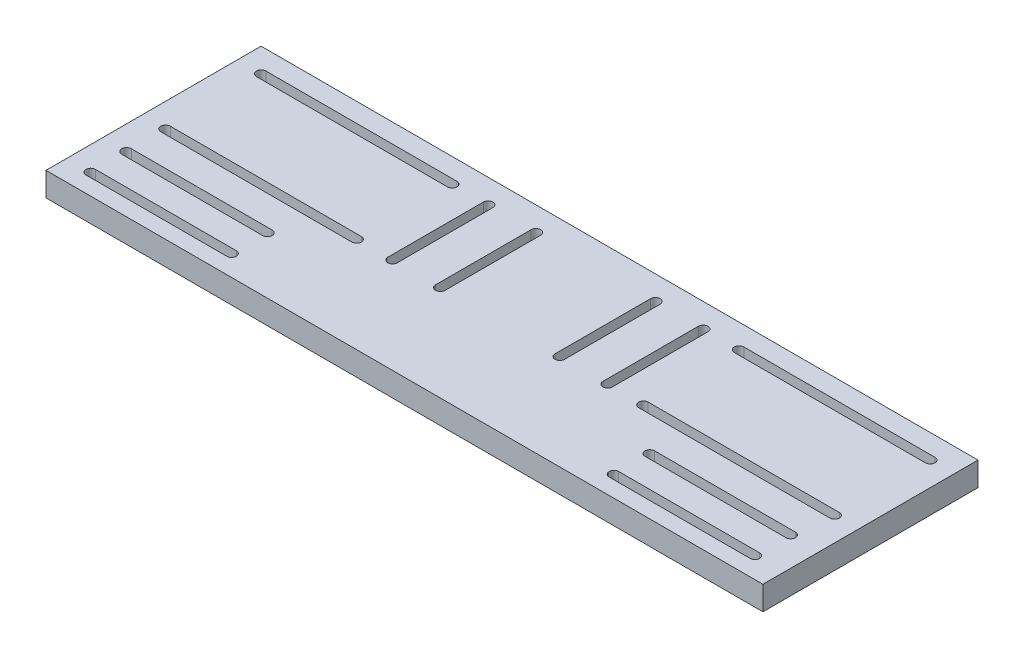
from build123d import *

# Parameters (mm, degrees)
SKETCH1_W           = 300
SKETCH1_H           = 30
BOSS_EXTRUDE1_DEPTH = 10
SKETCH2_W           = 300
SKETCH2_H           = 10
BOSS_EXTRUDE2_DEPTH = 60
CUT_EXTRUDE1_DEPTH  = 307.1045573


with BuildPart() as part:
    # Sketch1 → Boss-Extrude1 (new body)
    with BuildSketch(Plane(origin=(0, 0, 0), x_dir=(1, 0, 0), z_dir=(0, 1, 0))):
        with Locations((150, -15)):
            Rectangle(SKETCH1_W, SKETCH1_H)
        with BuildLine():
            Line((68.977444605, -8.309450677), (10, -8.309450677))
            ThreePointArc((10, -8.309450677), (8, -6.309450677), (10, -4.309450677))
            Line((10, -4.309450677), (68.977444605, -4.309450677))
            ThreePointArc((68.977444605, -4.309450677), (70.977444605, -6.309450677), (68.977444605, -8.309450677))
        make_face(mode=Mode.SUBTRACT)
        with BuildLine():
            Line((68.977444605, -23.309450677), (10, -23.309450677))
            ThreePointArc((10, -23.309450677), (8, -21.309450677), (10, -19.309450677))
            Line((10, -19.309450677), (68.977444605, -19.309450677))
            ThreePointArc((68.977444605, -19.309450677), (70.977444605, -21.309450677), (68.977444605, -23.309450677))
        make_face(mode=Mode.SUBTRACT)
        with BuildLine():
            Line((228.977444605, -23.309450677), (287.95488921, -23.309450677))
            ThreePointArc((287.95488921, -23.309450677), (289.95488921, -21.309450677), (287.95488921, -19.309450677))
            Line((287.95488921, -19.309450677), (228.977444605, -19.309450677))
            ThreePointArc((228.977444605, -19.309450677), (226.977444605, -21.309450677), (228.977444605, -23.309450677))
        make_face(mode=Mode.SUBTRACT)
        with BuildLine():
            Line((228.977444605, -8.309450677), (287.95488921, -8.309450677))
            ThreePointArc((287.95488921, -8.309450677), (289.95488921, -6.309450677), (287.95488921, -4.309450677))
            Line((287.95488921, -4.309450677), (228.977444605, -4.309450677))
            ThreePointArc((228.977444605, -4.309450677), (226.977444605, -6.309450677), (228.977444605, -8.309450677))
        make_face(mode=Mode.SUBTRACT)
    extrude(amount=BOSS_EXTRUDE1_DEPTH)

    # Sketch2 → Boss-Extrude2 (add)
    with BuildSketch(Plane(origin=(0, 0, 0), x_dir=(-1, 0, 0), z_dir=(0, 0, -1))):
        with Locations((-150, 5)):
            Rectangle(SKETCH2_W, SKETCH2_H)
    extrude(amount=BOSS_EXTRUDE2_DEPTH)

    # Sketch3 → Cut-Extrude1 (cut, through all)
    with BuildSketch(Plane(origin=(0, 10, 0), x_dir=(1, 0, 0), z_dir=(0, 1, 0))):
        with BuildLine():
            Line((10, 52), (90, 52))
            ThreePointArc((90, 52), (92, 50), (90, 48))
            Line((90, 48), (10, 48))
            ThreePointArc((10, 48), (8, 50), (10, 52))
        make_face()
        with BuildLine():
            Line((10, 12), (90, 12))
            ThreePointArc((90, 12), (92, 10), (90, 8))
            Line((90, 8), (10, 8))
            ThreePointArc((10, 8), (8, 10), (10, 12))
        make_face()
        with BuildLine():
            Line((127, 50), (127, 10))
            ThreePointArc((127, 10), (125, 8), (123, 10))
            Line((123, 10), (123, 50))
            ThreePointArc((123, 50), (125, 52), (127, 50))
        make_face()
        with BuildLine():
            Line((107, 50), (107, 10))
            ThreePointArc((107, 10), (105, 8), (103, 10))
            Line((103, 10), (103, 50))
            ThreePointArc((103, 50), (105, 52), (107, 50))
        make_face()
        with BuildLine():
            Line((290, 52), (210, 52))
            ThreePointArc((210, 52), (208, 50), (210, 48))
            Line((210, 48), (290, 48))
            ThreePointArc((290, 48), (292, 50), (290, 52))
        make_face()
        with BuildLine():
            Line((290, 12), (210, 12))
            ThreePointArc((210, 12), (208, 10), (210, 8))
            Line((210, 8), (290, 8))
            ThreePointArc((290, 8), (292, 10), (290, 12))
        make_face()
        with BuildLine():
            Line((173, 50), (173, 10))
            ThreePointArc((173, 10), (175, 8), (177, 10))
            Line((177, 10), (177, 50))
            ThreePointArc((177, 50), (175, 52), (173, 50))
        make_face()
        with BuildLine():
            Line((193, 50), (193, 10))
            ThreePointArc((193, 10), (195, 8), (197, 10))
            Line((197, 10), (197, 50))
            ThreePointArc((197, 50), (195, 52), (193, 50))
        make_face()
    extrude(amount=-CUT_EXTRUDE1_DEPTH, mode=Mode.SUBTRACT)


solid = part.part
